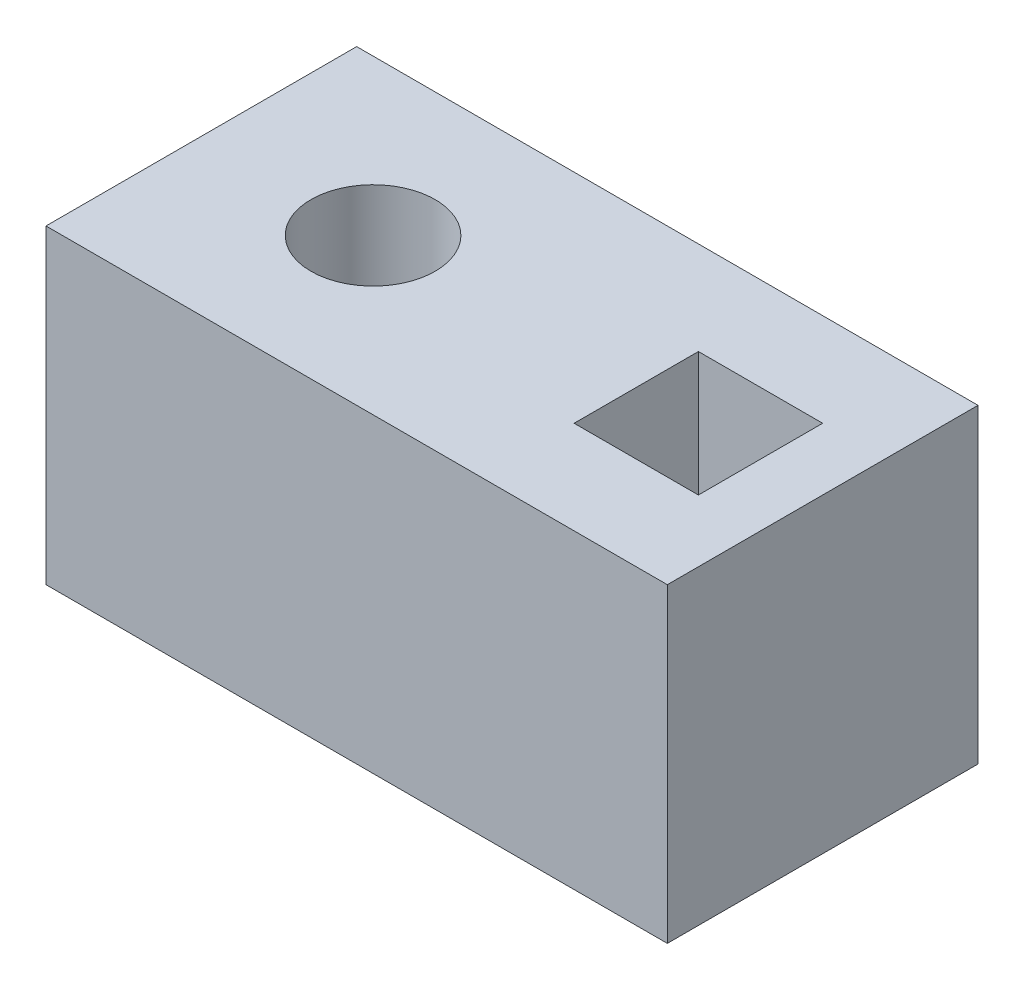
from build123d import *

# Parameters (mm, degrees)
SKETCH1_W           = 10
SKETCH1_H           = 5
SKETCH1_R           = 1
SKETCH1_W_2         = 2
SKETCH1_H_2         = 2
BOSS_EXTRUDE2_DEPTH = 5


with BuildPart() as part:
    # Sketch1 → Boss-Extrude2 (new body)
    with BuildSketch(Plane(origin=(0, 0, 0), x_dir=(1, 0, 0), z_dir=(0, 1, 0))):
        Rectangle(SKETCH1_W, SKETCH1_H)
        with Locations(Location((-2.236067977, 0, 0), (0, 0, 270))):
            Circle(SKETCH1_R, mode=Mode.SUBTRACT)
        with Locations((3, 0)):
            Rectangle(SKETCH1_W_2, SKETCH1_H_2, mode=Mode.SUBTRACT)
    extrude(amount=BOSS_EXTRUDE2_DEPTH)


solid = part.part
